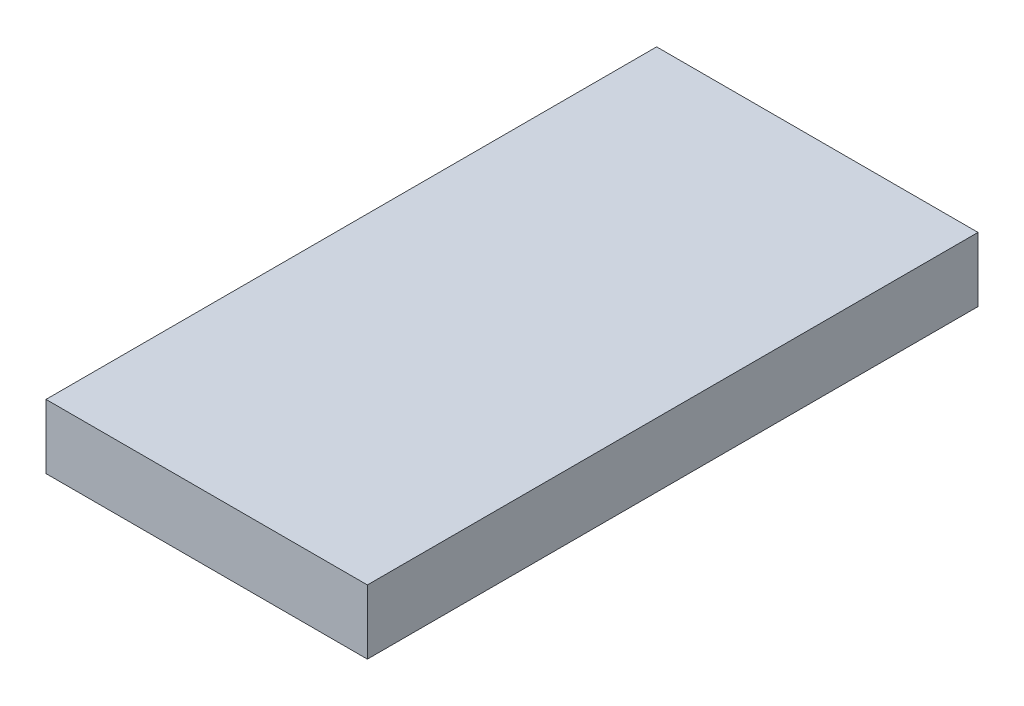
from build123d import *

# Parameters (mm, degrees)
ESQUISSE2_W        = 100
ESQUISSE2_H        = 190
BOSS_EXTRU_1_DEPTH = 20


with BuildPart() as part:
    # Esquisse2 → Boss.-Extru.1 (new body)
    with BuildSketch(Plane(origin=(0, 0, 0), x_dir=(1, 0, 0), z_dir=(0, 1, 0))):
        with Locations((29.792944785, -85.337423313)):
            Rectangle(ESQUISSE2_W, ESQUISSE2_H)
    extrude(amount=BOSS_EXTRU_1_DEPTH)


solid = part.part
